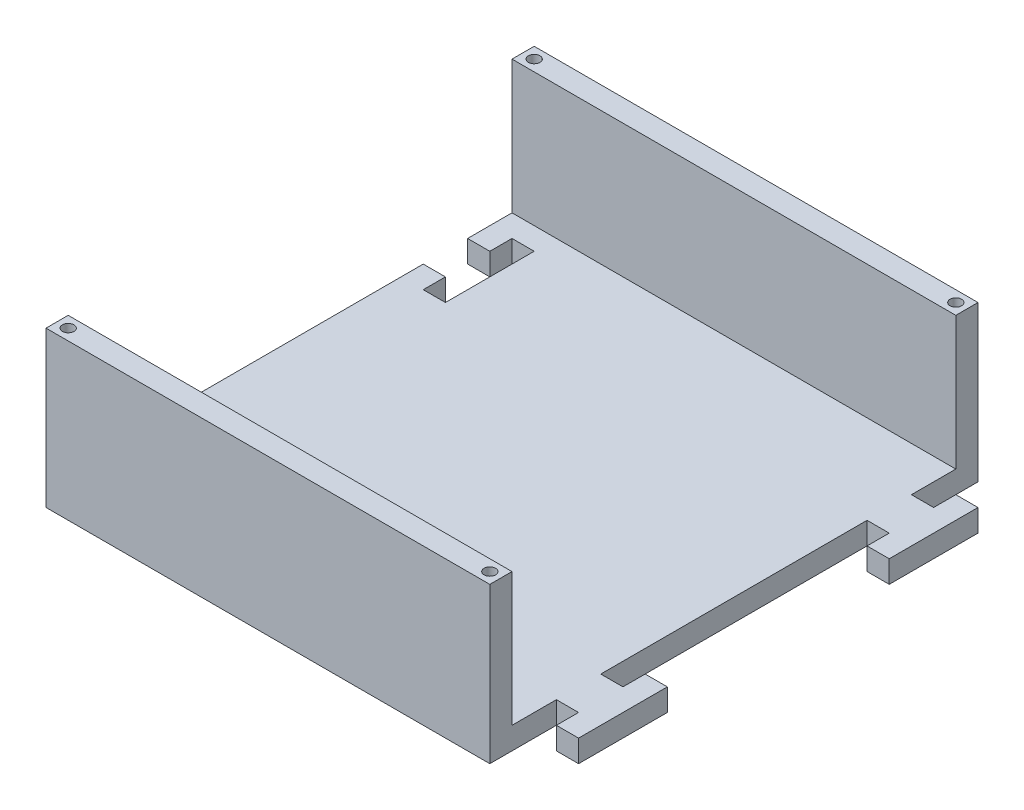
from build123d import *

# Parameters (mm, degrees)
SKETCH1_W                                  = 127
SKETCH1_H                                  = 139.7
BOSS_EXTRUDE1_DEPTH                        = 6.35
SKETCH3_W                                  = 127
SKETCH3_H                                  = 6.35
BOSS_EXTRUDE2_DEPTH                        = 38.1
BOSS_EXTRUDE3_DEPTH                        = 6.35
CUT_EXTRUDE2_DEPTH                         = 106.875658203
SKETCH8_R                                  = 1.65
CUT_EXTRUDE3_DEPTH                         = 12
MIRROR2_AT_THE_SECOND_PLANE_COPY_1_SKETC_R = 1.65
MIRROR2_AT_THE_SECOND_PLANE_COPY_1_DEPTH   = 12


with BuildPart() as part:
    # Sketch1 → Boss-Extrude1 (new body)
    with BuildSketch(Plane(origin=(0, 0, 0), x_dir=(1, 0, 0), z_dir=(0, 1, 0))):
        with Locations((-6.35, 0)):
            Rectangle(SKETCH1_W, SKETCH1_H)
    extrude(amount=BOSS_EXTRUDE1_DEPTH)

    # Sketch3 → Boss-Extrude2 (add)
    with BuildSketch(Plane(origin=(0, 6.35, 0), x_dir=(1, 0, 0), z_dir=(0, 1, 0))):
        with Locations((-6.35, 66.675)):
            Rectangle(SKETCH3_W, SKETCH3_H)
        with Locations((-6.35, -66.675)):
            Rectangle(SKETCH3_W, SKETCH3_H)
    extrude(amount=BOSS_EXTRUDE2_DEPTH)

    # Sketch6 → Boss-Extrude3 (add)
    with BuildSketch(Plane(origin=(0, 6.35, 0), x_dir=(1, 0, 0), z_dir=(0, 1, 0))):
        Polygon((57.15, 50.8), (63.5, 50.8), (63.5, 57.15), (69.85, 57.15), (69.85, 31.75), (63.5, 31.75), (63.5, 38.1), (57.15, 38.1), align=None)
    boss_extrude3 = extrude(amount=-BOSS_EXTRUDE3_DEPTH)

    # Sketch7 → Cut-Extrude2 (cut, through all)
    with BuildSketch(Plane(origin=(0, 6.35, 0), x_dir=(1, 0, 0), z_dir=(0, 1, 0))):
        Polygon((-69.85, 50.8), (-63.5, 50.8), (-63.5, 57.15), (-57.15, 57.15), (-57.15, 31.75), (-63.5, 31.75), (-63.5, 38.1), (-69.85, 38.1), align=None)
    cut_extrude2 = extrude(amount=-CUT_EXTRUDE2_DEPTH, mode=Mode.SUBTRACT)

    # Mirror1: Boss-Extrude3, Cut-Extrude2 across plane
    add(boss_extrude3.mirror(Plane.XY))
    add(cut_extrude2.mirror(Plane.XY), mode=Mode.SUBTRACT)

    # Sketch8 → Cut-Extrude3 (cut)
    with BuildSketch(Plane(origin=(0, 44.45, 0), x_dir=(1, 0, 0), z_dir=(0, 1, 0))):
        with Locations(Location((-66.675, 66.675, 0), (0, 0, 270))):
            Circle(SKETCH8_R)
    cut_extrude3 = extrude(amount=-CUT_EXTRUDE3_DEPTH, mode=Mode.SUBTRACT)

    # Mirror2: Cut-Extrude3 across plane
    add(cut_extrude3.mirror(Plane.XY), mode=Mode.SUBTRACT)

    # Mirror2 at the second plane: Cut-Extrude3 across plane
    add(cut_extrude3.mirror(Plane.ZY.offset(6.35)), mode=Mode.SUBTRACT)

    # Mirror2 at the second plane copy 1 sketc → Mirror2 at the second plane copy 1 (cut)
    with BuildSketch(Plane(origin=(-12.7, 44.45, 0), x_dir=(-1, 0, 0), z_dir=(0, 1, 0))):
        with Locations(Location((-66.675, 66.675, 0), (0, 0, 270))):
            Circle(MIRROR2_AT_THE_SECOND_PLANE_COPY_1_SKETC_R)
    extrude(amount=-MIRROR2_AT_THE_SECOND_PLANE_COPY_1_DEPTH, mode=Mode.SUBTRACT)


solid = part.part
